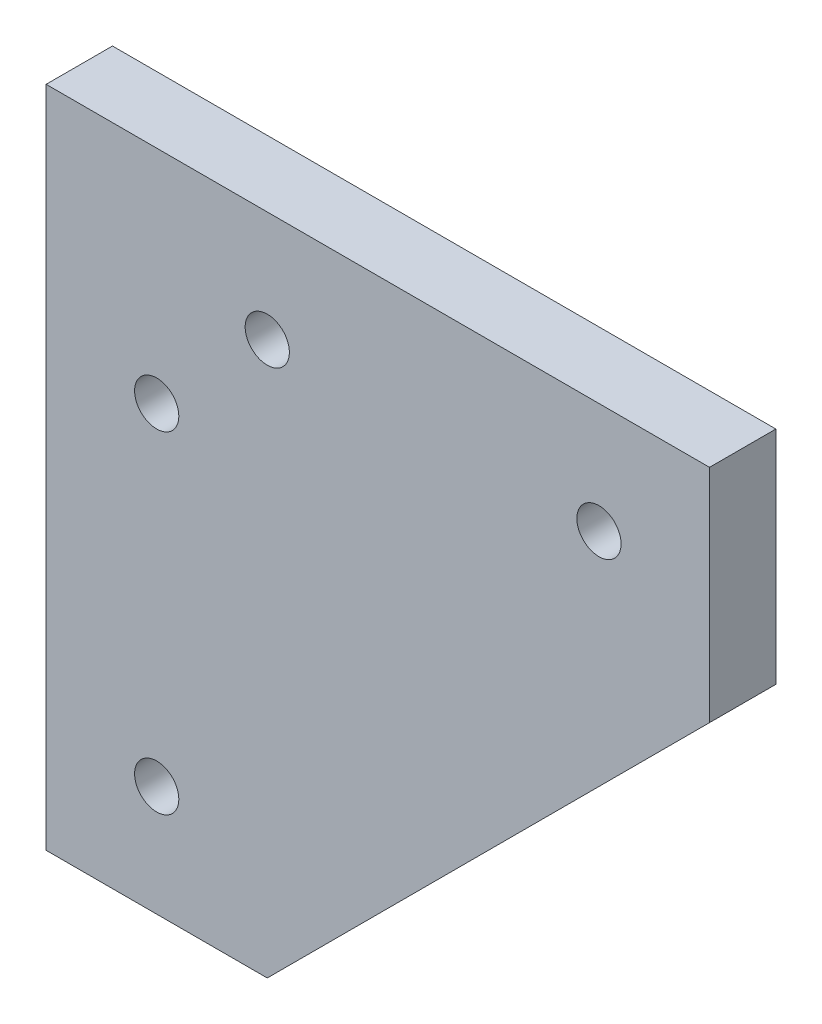
from build123d import *

# Parameters (mm, degrees)
SKETCH1_R           = 2
BOSS_EXTRUDE1_DEPTH = 6


with BuildPart() as part:
    # Sketch1 → Boss-Extrude1 (new body)
    with BuildSketch(Plane.XY):
        Polygon((20, -60), (60, -20), (60, 0), (0, 0), (0, -60), align=None)
        with Locations((50, -10)):
            Circle(SKETCH1_R, mode=Mode.SUBTRACT)
        with Locations((20, -10)):
            Circle(SKETCH1_R, mode=Mode.SUBTRACT)
        with Locations((10, -50)):
            Circle(SKETCH1_R, mode=Mode.SUBTRACT)
        with Locations((10, -20)):
            Circle(SKETCH1_R, mode=Mode.SUBTRACT)
    extrude(amount=BOSS_EXTRUDE1_DEPTH)


solid = part.part
